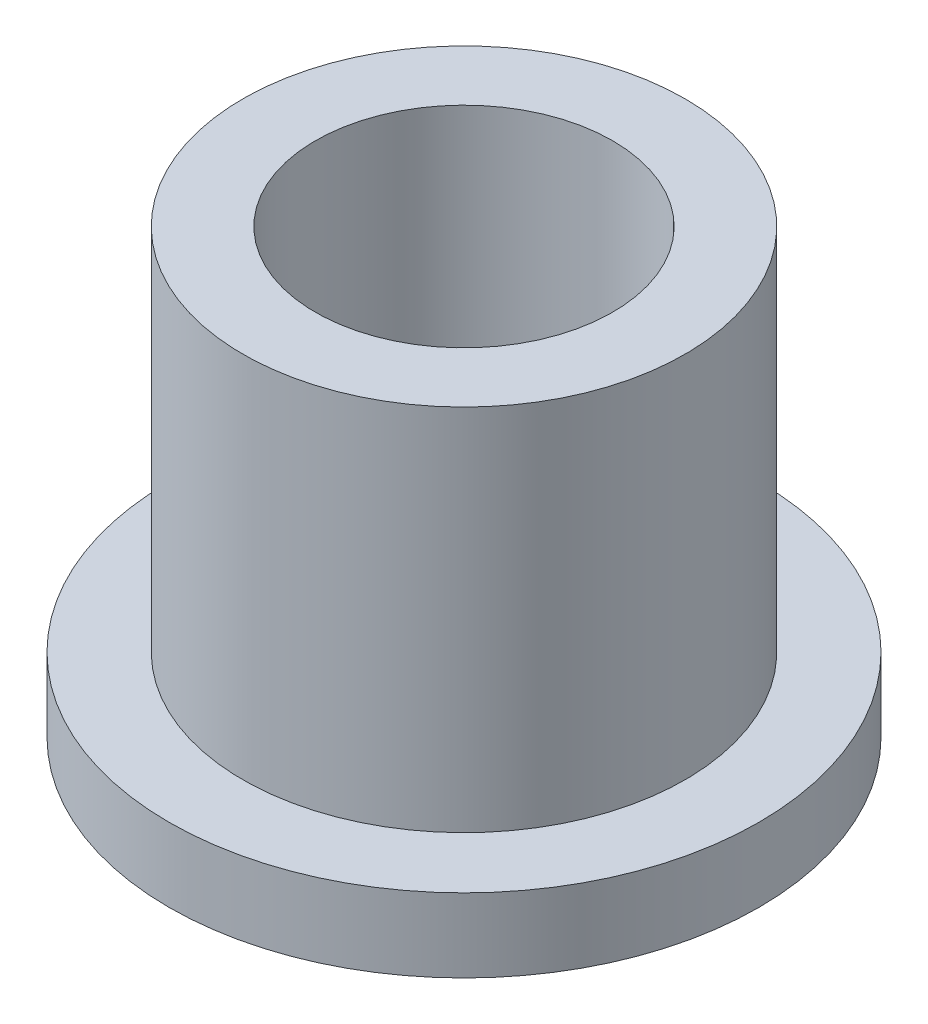
from build123d import *

# Parameters (mm, degrees)
SKETCH2_R           = 9.525
SKETCH2_R_2         = 6.4008
BOSS_EXTRUDE1_DEPTH = 19.05
SKETCH3_R           = 12.7
SKETCH3_R_2         = 9.525
BOSS_EXTRUDE2_DEPTH = 3.175


with BuildPart() as part:
    # Sketch2 → Boss-Extrude1 (new body)
    with BuildSketch(Plane(origin=(0, 0, 0), x_dir=(1, 0, 0), z_dir=(0, 1, 0))):
        with Locations(Location((0, 0, 0), (0, 0, 90))):
            Circle(SKETCH2_R)
        with Locations(Location((0, 0, 0), (0, 0, 90))):
            Circle(SKETCH2_R_2, mode=Mode.SUBTRACT)
    extrude(amount=BOSS_EXTRUDE1_DEPTH)

    # Sketch3 → Boss-Extrude2 (add)
    with BuildSketch(Plane(origin=(0, 0, 0), x_dir=(1, 0, 0), z_dir=(0, 1, 0))):
        with Locations(Location((0, 0, 0), (0, 0, 270))):
            Circle(SKETCH3_R)
        with Locations(Location((0, 0, 0), (0, 0, 90))):
            Circle(SKETCH3_R_2, mode=Mode.SUBTRACT)
    extrude(amount=BOSS_EXTRUDE2_DEPTH)


solid = part.part
